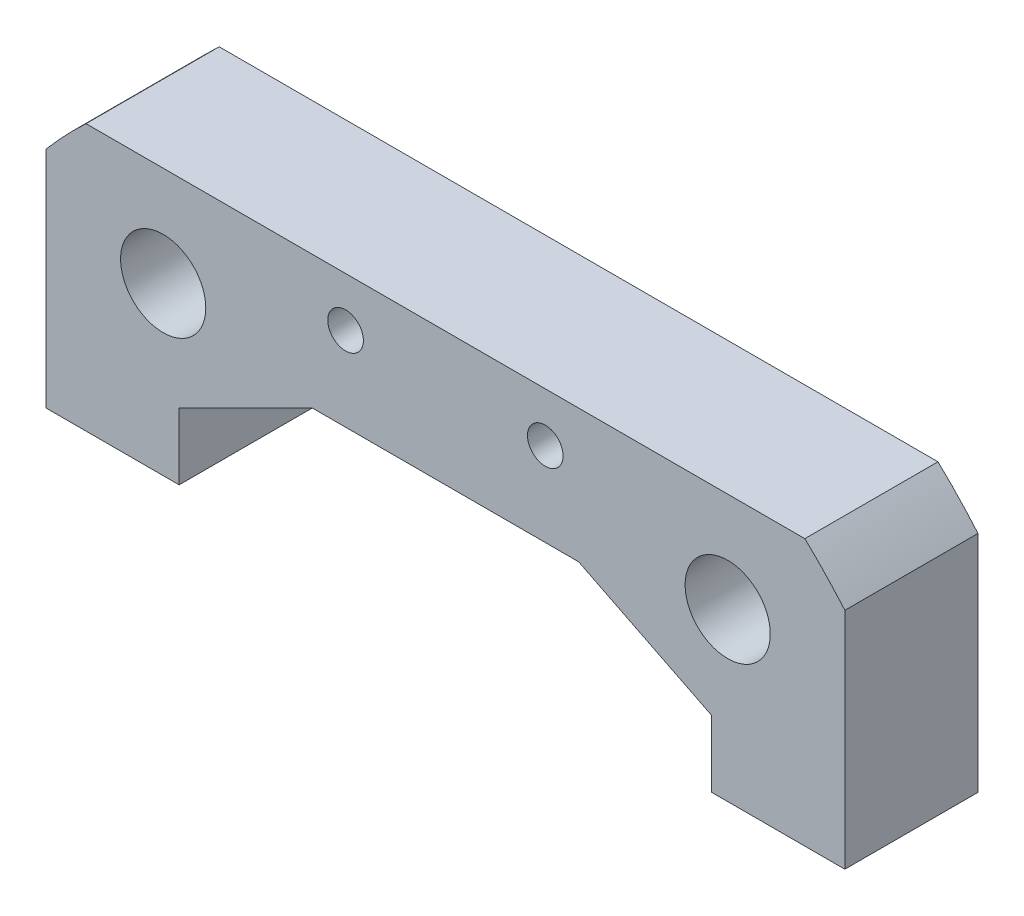
from build123d import *

# Parameters (mm, degrees)
SKETCH1_R           = 4.064
BOSS_EXTRUDE1_DEPTH = 12.7
SKETCH2_R           = 1.6999966
SKETCH2_R_2         = 1.7
CUT_EXTRUDE1_DEPTH  = 48.519048812


with BuildPart() as part:
    # Sketch1 → Boss-Extrude1 (new body)
    with BuildSketch(Plane.XY):
        Polygon((0, 0), (-38.1, 0), (-38.1, -25.4), (-25.4, -25.4), (-25.4, -19.05), (-12.7, -12.7), (0, -12.7), align=None)
        with Locations((-26.924, -9.525)):
            Circle(SKETCH1_R, mode=Mode.SUBTRACT)
    boss_extrude1 = extrude(amount=BOSS_EXTRUDE1_DEPTH)

    # Mirror1: Boss-Extrude1 across plane
    add(boss_extrude1.mirror(Plane(origin=(0, -12.7, 12.7), x_dir=(0, 0, 1), z_dir=(-1, 0, 0))))

    # Sketch2 → Cut-Extrude1 (cut, through all)
    with BuildSketch(Plane.XY.offset(12.7)):
        with Locations((-9.525, -4.699)):
            Circle(SKETCH2_R)
        with Locations((9.525, -4.699)):
            Circle(SKETCH2_R_2)
        with BuildLine():
            Line((-38.1, -4.011499418), (-38.1, 0))
            Line((-38.1, 0), (-34.28223801, 0))
            ThreePointArc((-34.28223801, 0), (-36.246656766, -1.952894173), (-38.1, -4.011499418))
        make_face()
        with BuildLine():
            Line((34.28223801, 0), (38.1, 0))
            Line((38.1, 0), (38.1, -4.011499418))
            ThreePointArc((38.1, -4.011499418), (36.246656766, -1.952894173), (34.28223801, 0))
        make_face()
    extrude(amount=-CUT_EXTRUDE1_DEPTH, mode=Mode.SUBTRACT)


solid = part.part
